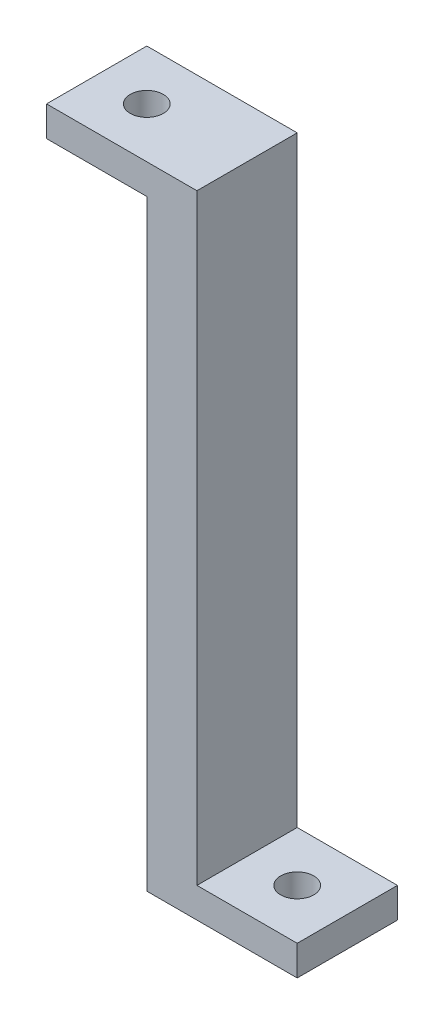
from build123d import *

# Parameters (mm, degrees)
EXTRUDE_1_DEPTH     = 10
SKETCH_3_R          = 1.65
CUT_EXTRUDE_1_DEPTH = 10
SKETCH_4_R          = 1.65
CUT_EXTRUDE_2_DEPTH = 10


with BuildPart() as part:
    # ｽｹｯﾁ1 → ﾎﾞｽ - 押し出し1 (new body)
    with BuildSketch(Plane.XY):
        Polygon((0, 0), (-10, 0), (-10, 3), (5, 3), (5, -57), (15, -57), (15, -60), (0, -60), align=None)
    extrude(amount=EXTRUDE_1_DEPTH)

    # ｽｹｯﾁ3 → ｶｯﾄ - 押し出し1 (cut)
    with BuildSketch(Plane(origin=(0, 3, 0), x_dir=(1, 0, 0), z_dir=(0, 1, 0))):
        with Locations(Location((-5, -5, 0), (0, 0, 180))):
            Circle(SKETCH_3_R)
    extrude(amount=-CUT_EXTRUDE_1_DEPTH, mode=Mode.SUBTRACT)

    # ｽｹｯﾁ4 → ｶｯﾄ - 押し出し2 (cut)
    with BuildSketch(Plane(origin=(0, -57, 0), x_dir=(1, 0, 0), z_dir=(0, 1, 0))):
        with Locations(Location((10, -5, 0), (0, 0, 270))):
            Circle(SKETCH_4_R)
    extrude(amount=-CUT_EXTRUDE_2_DEPTH, mode=Mode.SUBTRACT)


solid = part.part
